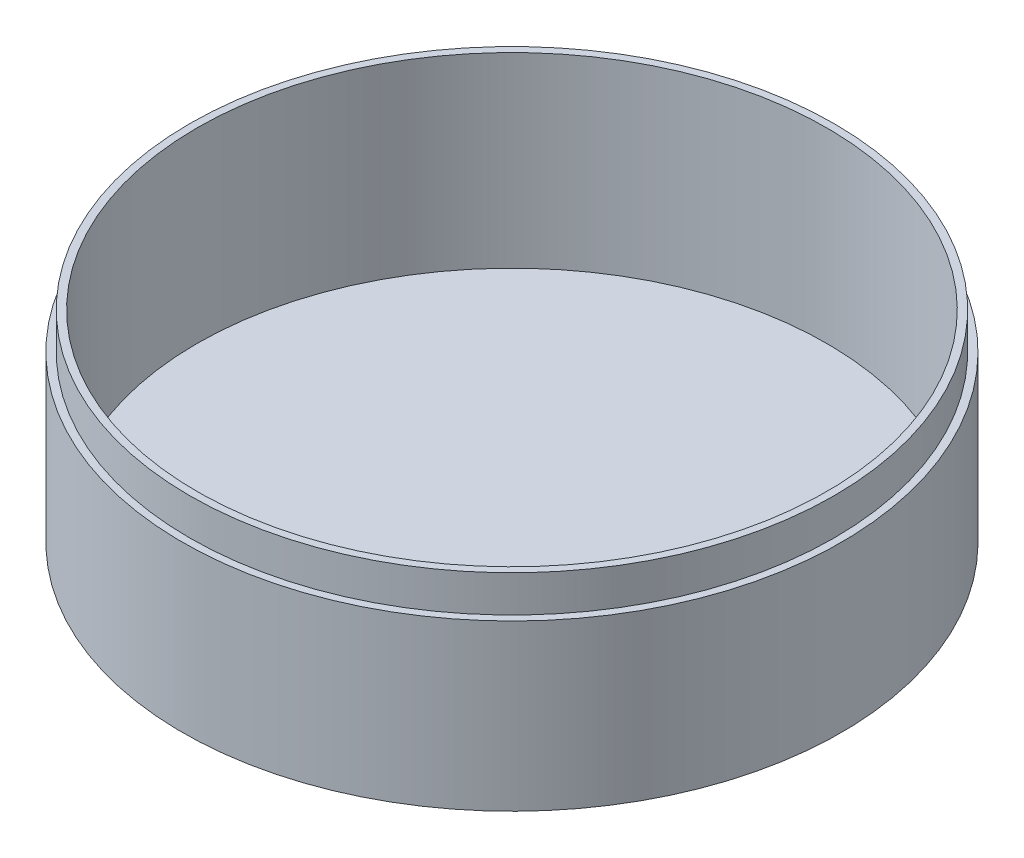
from build123d import *


with BuildPart() as part:
    # Sketch1 → Revolve1 (revolve)
    with BuildSketch(Plane.XY, mode=Mode.PRIVATE) as revolve1_sk:
        Polygon((0, 0), (114.3, 0), (114.3, 57.15), (111.76, 57.15), (111.76, 69.85), (109.22, 69.85), (109.22, 5.08), (0, 5.08), align=None)
    revolve(revolve1_sk.sketch.rotate(Axis((0, 5.08, 0), (0, -1, 0)), 180), axis=Axis((0, 5.08, 0), (0, -1, 0)))


solid = part.part
